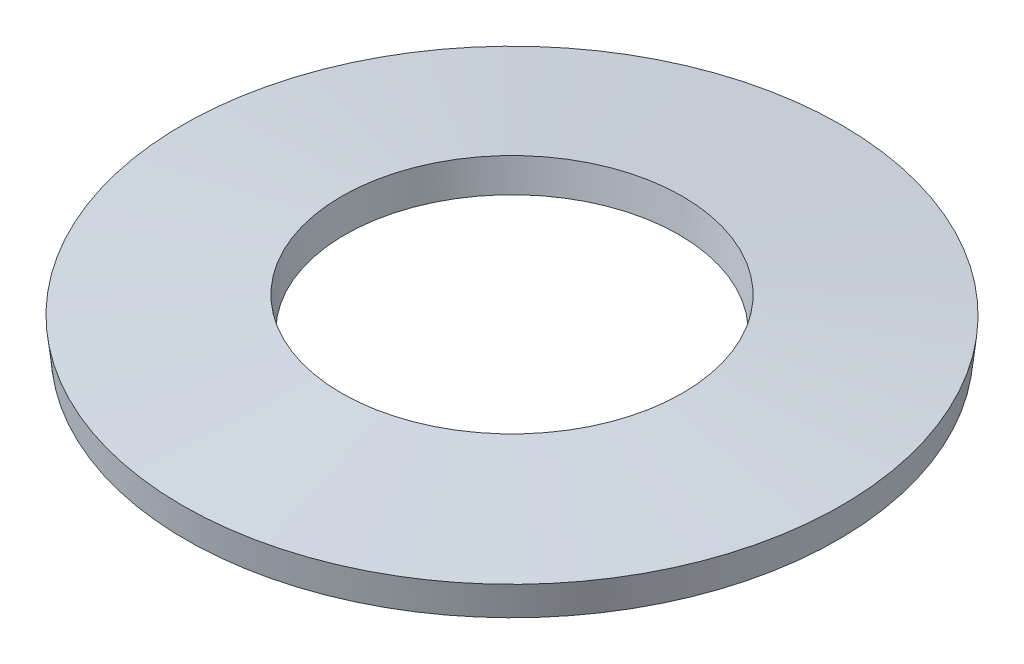
from build123d import *


with BuildPart() as part:
    # Sketch1 → Revolve1 (revolve)
    with BuildSketch(Plane.XY, mode=Mode.PRIVATE) as revolve1_sk:
        Polygon((4.711735006, 0), (2.413, 0.256827075), (2.463764994, 0.7112), (4.7625, 0.454372925), align=None)
    revolve(revolve1_sk.sketch.rotate(Axis((0, 0, 0), (0, 1, 0)), 90), axis=Axis((0, 0, 0), (0, 1, 0)))


solid = part.part
